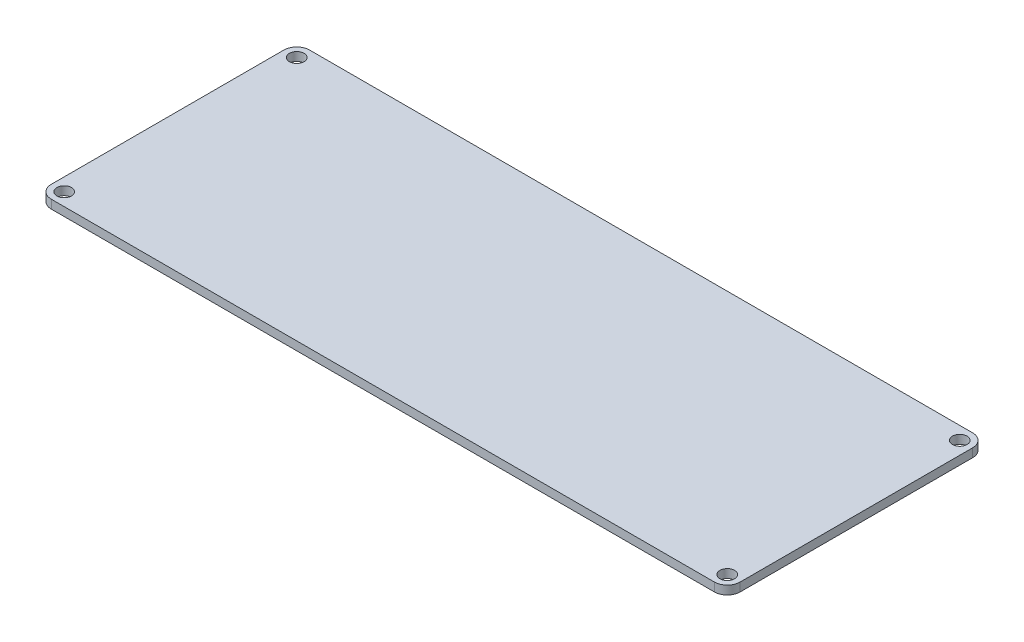
from build123d import *

# Parameters (mm, degrees)
SKETCH1_W                = 160
SKETCH1_H                = 60
BOSS_EXTRUDE1_DEPTH      = 2
FILLET1_R                = 3
M3_CLEARANCE_HOLE1_D     = 3.4
M3_CLEARANCE_HOLE1_DEPTH = 10


with BuildPart() as part:
    # Sketch1 → Boss-Extrude1 (new body)
    with BuildSketch(Plane(origin=(0, 0, 0), x_dir=(1, 0, 0), z_dir=(0, 1, 0))):
        Rectangle(SKETCH1_W, SKETCH1_H)
    extrude(amount=BOSS_EXTRUDE1_DEPTH)

    # Fillet1
    fillet1_edges = [part.edges().sort_by_distance(p)[0] for p in [
        (80, 1, 30),
        (-80, 1, 30),
        (-80, 1, -30),
        (80, 1, -30),
    ]]
    fillet(fillet1_edges, radius=FILLET1_R)

    # M3 Clearance Hole1
    with Locations(Plane(origin=(0, 2, 0), x_dir=(1, 0, 0), z_dir=(0, 1, 0))):
        with Locations((-77, 27), (-77, -27), (77, 27), (77, -27)):
            Hole(M3_CLEARANCE_HOLE1_D / 2, depth=M3_CLEARANCE_HOLE1_DEPTH)


solid = part.part
